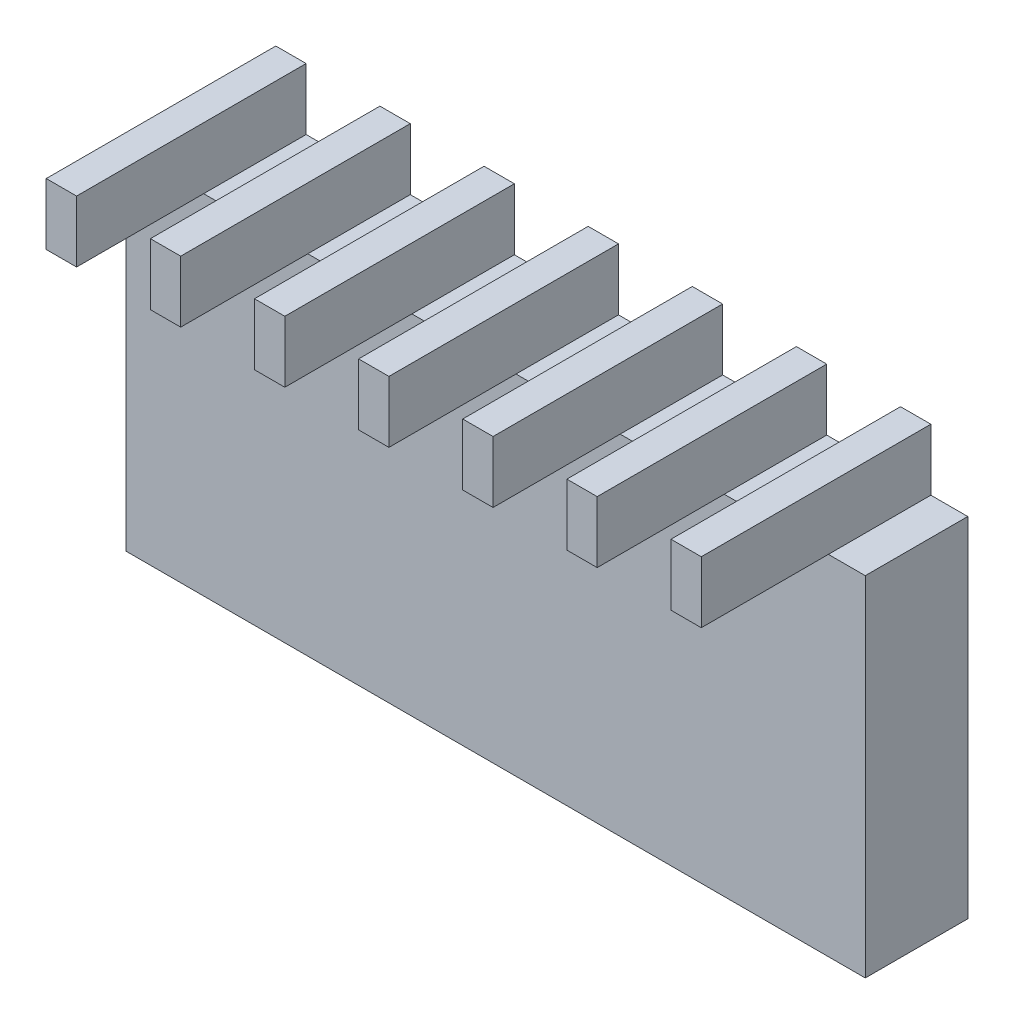
from build123d import *

# Parameters (mm, degrees)
SKETCH_1_W               = 25.9
SKETCH_1_H               = 8.5
EXTRUDE_1_DEPTH          = 2.5
SKETCH_1_5_W             = 23.6
SKETCH_1_5_H             = 1.5
EXTRUDE_2_DEPTH          = 2.5
SKETCH_2_W               = 23.6
SKETCH_2_H               = 1.5
EXTRUDE_3_DEPTH          = 3.1
SKETCH_3_W               = 1.8
SKETCH_3_H               = 5.6
CUT_EXTRUDE_1_DEPTH      = 1.5
CUT_EXTRUDE_2_DEPTH      = 2
CUT_EXTRUDE_2_DEPTH_BACK = 10
SKETCH_4_W               = 8.769979371
SKETCH_4_H               = 7.729949766


with BuildPart() as part:
    # 草图1 → 凸台-拉伸1 (new body)
    with BuildSketch(Plane.XY):
        with Locations((7.382170543, 0.04770021)):
            Rectangle(SKETCH_1_W, SKETCH_1_H)
    extrude(amount=EXTRUDE_1_DEPTH)

    # 草图1<5> → 凸台-拉伸2 (add)
    with BuildSketch(Plane.XY):
        with Locations((7.382170543, 5.04770021)):
            Rectangle(SKETCH_1_5_W, SKETCH_1_5_H)
    extrude(amount=EXTRUDE_2_DEPTH)

    # 草图2 → 凸台-拉伸3 (add)
    with BuildSketch(Plane.XY.offset(2.5)):
        with Locations((7.382170543, 5.04770021)):
            Rectangle(SKETCH_2_W, SKETCH_2_H)
    extrude(amount=EXTRUDE_3_DEPTH)

    # 草图3 → 切除-拉伸1 (cut)
    with BuildSketch(Plane(origin=(0, 5.79770021, 0), x_dir=(1, 0, 0), z_dir=(0, 1, 0))):
        with Locations((17.542170543, -2.8)):
            Rectangle(SKETCH_3_W, SKETCH_3_H)
        with Locations((15.002170543, -2.8)):
            Rectangle(SKETCH_3_W, SKETCH_3_H)
        with Locations((12.462170543, -2.8)):
            Rectangle(SKETCH_3_W, SKETCH_3_H)
        with Locations((9.922170543, -2.8)):
            Rectangle(SKETCH_3_W, SKETCH_3_H)
        with Locations((7.382170543, -2.8)):
            Rectangle(SKETCH_3_W, SKETCH_3_H)
        with Locations((4.842170543, -2.8)):
            Rectangle(SKETCH_3_W, SKETCH_3_H)
        with Locations((2.302170543, -2.8)):
            Rectangle(SKETCH_3_W, SKETCH_3_H)
        with Locations((-0.237829457, -2.8)):
            Rectangle(SKETCH_3_W, SKETCH_3_H)
        with Locations((-2.777829457, -2.8)):
            Rectangle(SKETCH_3_W, SKETCH_3_H)
    extrude(amount=-CUT_EXTRUDE_1_DEPTH, mode=Mode.SUBTRACT)

    # 草图4 → 切除-拉伸2 (cut, two sides: drawn at the far end of the back side and taken through both)
    with BuildSketch(Plane(origin=(0, 4.29770021, 0), x_dir=(1, 0, 0), z_dir=(0, 1, 0)).offset(-CUT_EXTRUDE_2_DEPTH_BACK)):
        with Locations((16.847160229, -2.378366376)):
            Rectangle(SKETCH_4_W, SKETCH_4_H)
    extrude(amount=CUT_EXTRUDE_2_DEPTH + CUT_EXTRUDE_2_DEPTH_BACK, mode=Mode.SUBTRACT)


solid = part.part
